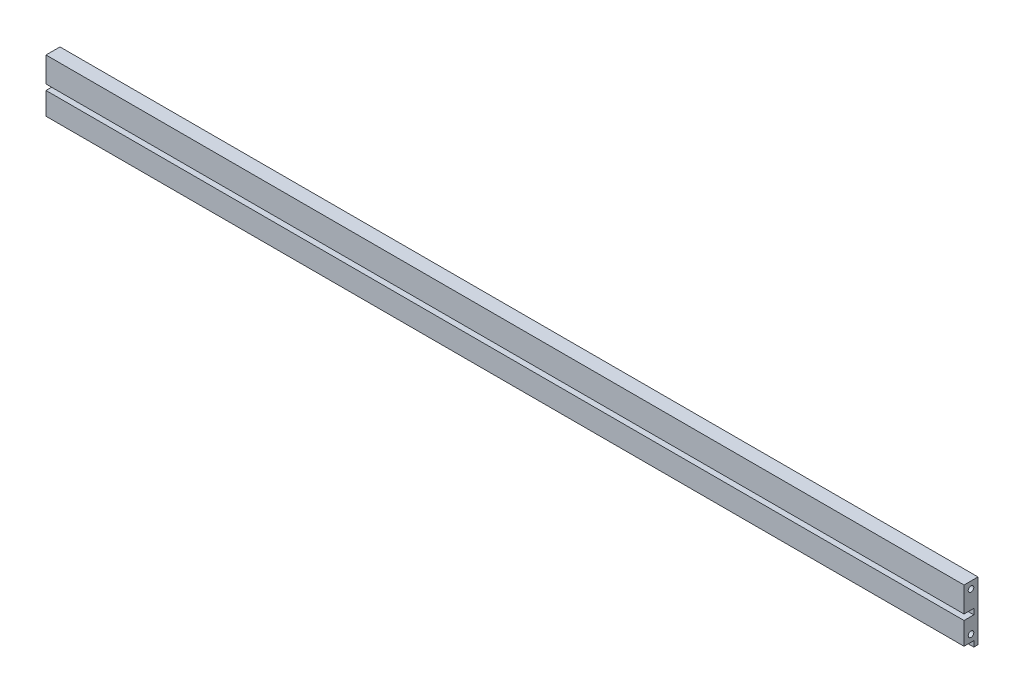
from build123d import *

# Parameters (mm, degrees)
SKETCH1_W           = 657
SKETCH1_H           = 42
BOSS_EXTRUDE1_DEPTH = 10
SKETCH2_W           = 657
SKETCH2_H           = 4
CUT_EXTRUDE1_DEPTH  = 7
SKETCH3_R           = 2
CUT_EXTRUDE2_DEPTH  = 10
CUT_EXTRUDE3_START  = -10
SKETCH4_R           = 2
CUT_EXTRUDE3_DEPTH  = 10
SKETCH5_R           = 1.5
CUT_EXTRUDE4_DEPTH  = 12


with BuildPart() as part:
    # Sketch1 → Boss-Extrude1 (new body)
    with BuildSketch(Plane.XY):
        with Locations((-281.102301223, -2.406262021)):
            Rectangle(SKETCH1_W, SKETCH1_H)
    extrude(amount=BOSS_EXTRUDE1_DEPTH)

    # Sketch2 → Cut-Extrude1 (cut)
    with BuildSketch(Plane.XY.offset(10)):
        with Locations((-281.102301223, -21.406262021)):
            Rectangle(SKETCH2_W, SKETCH2_H)
        with Locations((-281.102301223, -1.406262021)):
            Rectangle(SKETCH2_W, SKETCH2_H)
    extrude(amount=-CUT_EXTRUDE1_DEPTH, mode=Mode.SUBTRACT)

    # Sketch3 → Cut-Extrude2 (cut)
    with BuildSketch(Plane.ZY.offset(609.602301223)):
        with Locations((5, 13.593737979)):
            Circle(SKETCH3_R)
        with Locations((5, -14.406262021)):
            Circle(SKETCH3_R)
    extrude(amount=-CUT_EXTRUDE2_DEPTH, mode=Mode.SUBTRACT)

    # Sketch4 → Cut-Extrude3 (cut)
    with BuildSketch(Plane(origin=(47.397698777, 0, 0), x_dir=(0, 0, -1), z_dir=(1, 0, 0)).offset(CUT_EXTRUDE3_START)):
        with Locations(Location((-5, 13.593737979, 0), (0, 0, 180))):
            Circle(SKETCH4_R)
        with Locations(Location((-5, -14.406262021, 0), (0, 0, 180))):
            Circle(SKETCH4_R)
    extrude(amount=CUT_EXTRUDE3_DEPTH, mode=Mode.SUBTRACT)

    # Sketch5 → Cut-Extrude4 (cut)
    with BuildSketch(Plane(origin=(0, -19.406262021, 0), x_dir=(-1, 0, 0), z_dir=(0, -1, 0))):
        with Locations(Location((559.602301223, -6.5, 0), (0, 0, 90))):
            Circle(SKETCH5_R)
        with Locations(Location((281.102301223, -6.5, 0), (0, 0, 90))):
            Circle(SKETCH5_R)
        with Locations(Location((2.602301223, -6.5, 0), (0, 0, 90))):
            Circle(SKETCH5_R)
    extrude(amount=-CUT_EXTRUDE4_DEPTH, mode=Mode.SUBTRACT)


solid = part.part
